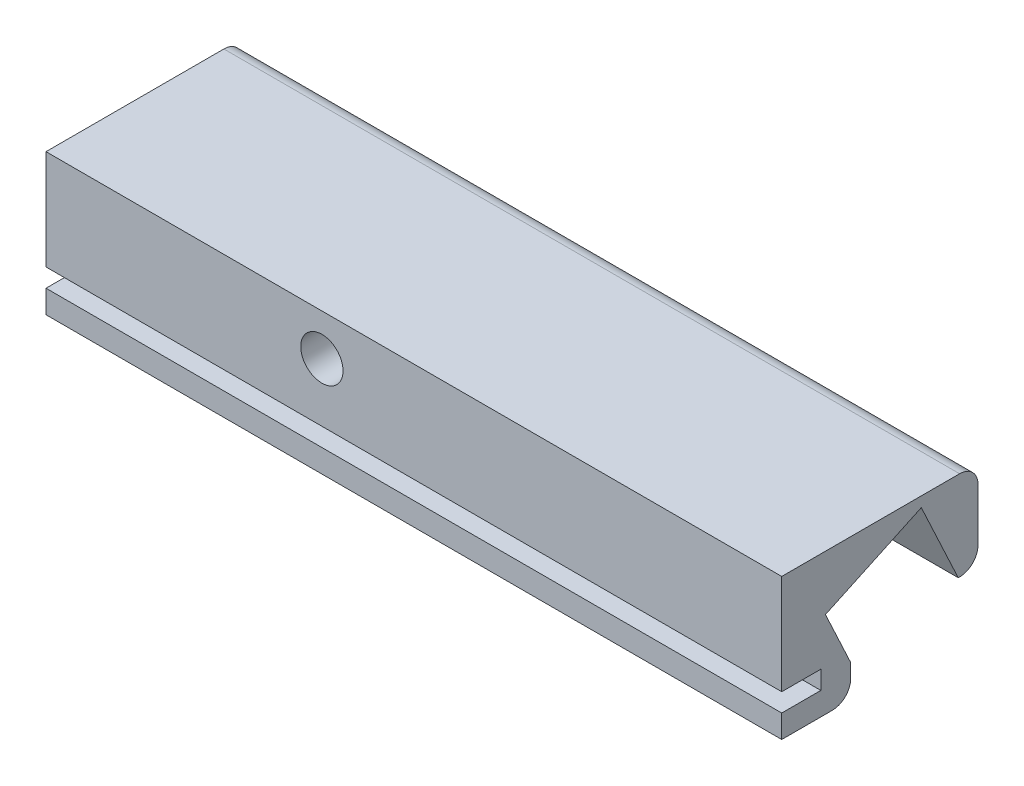
from build123d import *

# Parameters (mm, degrees)
PROFILEBOSS_EXTRUDE1_DEPTH           = 80
SKETCH2_R                            = 2.3
LEDSTRIPMOUNTHOLESCUT_EXTRUDE1_DEPTH = 4.5
SKETCH4_W                            = 28
SKETCH4_H                            = 11.5
POWERCONNECTORCUT_EXTRUDE4_DEPTH     = 6.5
SKETCH3_R                            = 2.3
MOUNTINGHOLESCUT_EXTRUDE3_DEPTH      = 4.5
SKETCH5_W                            = 80
SKETCH5_H                            = 2
XAXISCABLECUT_EXTRUDE1_DEPTH         = 4.25


with BuildPart() as part:
    # Sketch1 → ProfileBoss-Extrude1 (new body)
    with BuildSketch(Plane(origin=(0, 0, 0), x_dir=(0, 0, -1), z_dir=(1, 0, 0))):
        with BuildLine():
            Line((0, 0), (5.499461553, 0))
            ThreePointArc((5.499461553, 0), (6.914055855, 0.585944145), (7.5, 2.000538447))
            Line((7.5, 2.000538447), (7.5, 3.5))
            Line((7.5, 3.5), (17.922539551, 8.36011001))
            Line((17.922539551, 8.36011001), (19.190394336, 5.641186649))
            ThreePointArc((19.190394336, 5.641186649), (20.700753359, 6.16912635), (21.340729536, 7.635528477))
            Line((21.340729536, 7.635528477), (21.340729536, 13.36011001))
            ThreePointArc((21.340729536, 13.36011001), (20.754943098, 14.774323572), (19.340729536, 15.36011001))
            Line((19.340729536, 15.36011001), (0, 15.36011001))
            Line((0, 15.36011001), (0, 0))
        make_face()
    extrude(amount=PROFILEBOSS_EXTRUDE1_DEPTH)

    # Sketch2 → LedStripMountHolesCut-Extrude1 (cut)
    with BuildSketch(Plane(origin=(0, 0.002211655, 0.001031312), x_dir=(1, 0, 0), z_dir=(0, -0.906307787036651, -0.4226182617406973))):
        with Locations(Location((43.85, -14.026472319, 0), (0, 0, 270))):
            Circle(SKETCH2_R)
    extrude(amount=-LEDSTRIPMOUNTHOLESCUT_EXTRUDE1_DEPTH, mode=Mode.SUBTRACT)

    # Sketch4 → PowerConnectorCut-Extrude4 (cut)
    with BuildSketch(Plane(origin=(0, 0.002211655, 0.001031312), x_dir=(1, 0, 0), z_dir=(0, -0.906307787036651, -0.4226182617406973))):
        with Locations((66, -14.026472319)):
            Rectangle(SKETCH4_W, SKETCH4_H)
    extrude(amount=-POWERCONNECTORCUT_EXTRUDE4_DEPTH, mode=Mode.SUBTRACT)

    # Sketch3 → MountingHolesCut-Extrude3 (cut)
    with BuildSketch(Plane.XY):
        with Locations((30, 10.86011001)):
            Circle(SKETCH3_R)
    extrude(amount=-MOUNTINGHOLESCUT_EXTRUDE3_DEPTH, mode=Mode.SUBTRACT)

    # Sketch5 → XAxisCableCut-Extrude1 (cut)
    with BuildSketch(Plane.XY):
        with Locations((40, 3.5)):
            Rectangle(SKETCH5_W, SKETCH5_H)
    extrude(amount=-XAXISCABLECUT_EXTRUDE1_DEPTH, mode=Mode.SUBTRACT)


solid = part.part
